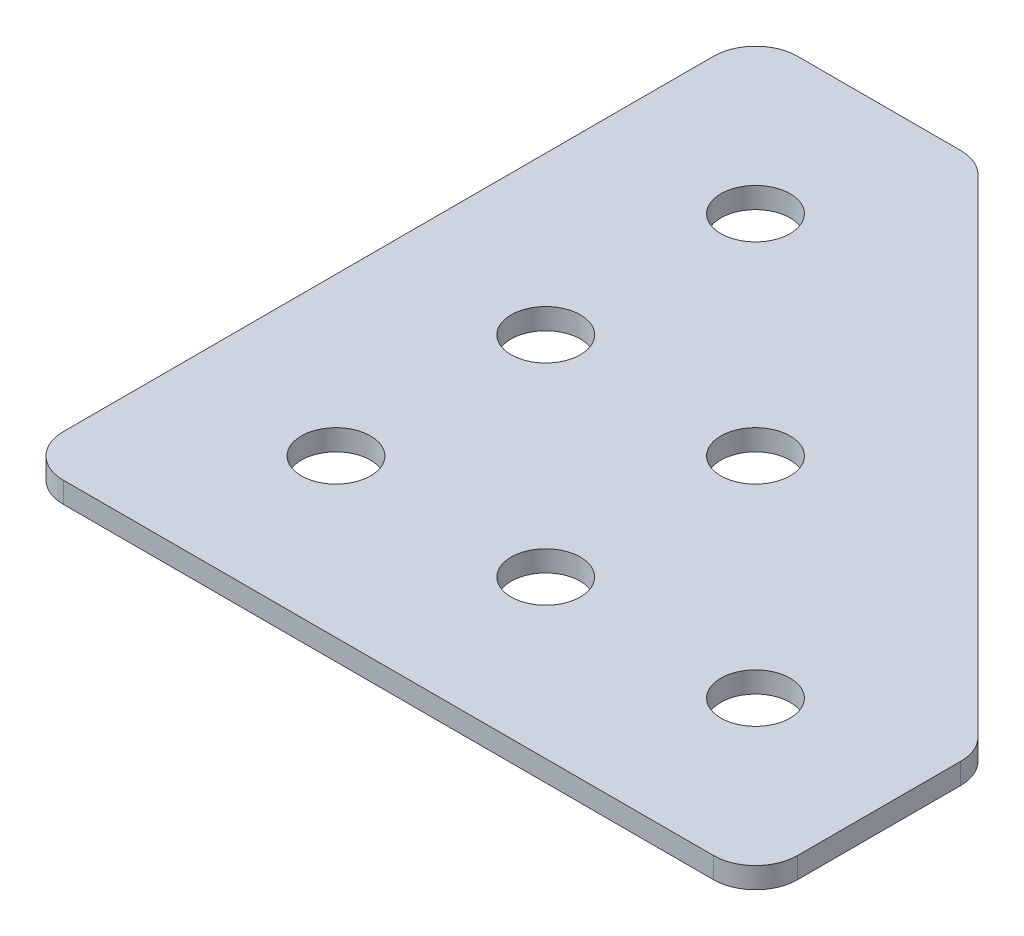
from build123d import *

# Parameters (mm, degrees)
SKETCH1_R           = 1.65
BOSS_EXTRUDE1_DEPTH = 1


with BuildPart() as part:
    # Sketch1 → Boss-Extrude1 (new body)
    with BuildSketch(Plane(origin=(0, 0, 0), x_dir=(1, 0, 0), z_dir=(0, 1, 0))):
        with BuildLine():
            Line((0, 2), (0, 33))
            ThreePointArc((0, 33), (0.585786438, 34.414213562), (2, 35))
            Line((2, 35), (9.778174593, 35))
            ThreePointArc((9.778174593, 35), (10.543541458, 34.847759065), (11.192388155, 34.414213562))
            Line((11.192388155, 34.414213562), (34.414213562, 11.192388155))
            ThreePointArc((34.414213562, 11.192388155), (34.847759065, 10.543541458), (35, 9.778174593))
            Line((35, 9.778174593), (35, 2))
            ThreePointArc((35, 2), (34.414213562, 0.585786438), (33, 0))
            Line((33, 0), (2, 0))
            ThreePointArc((2, 0), (0.585786438, 0.585786438), (0, 2))
        make_face()
        with Locations(Location((7.5, 7.5, 0), (0, 0, 270))):
            Circle(SKETCH1_R, mode=Mode.SUBTRACT)
        with Locations(Location((7.5, 27.5, 0), (0, 0, 270))):
            Circle(SKETCH1_R, mode=Mode.SUBTRACT)
        with Locations(Location((17.5, 7.5, 0), (0, 0, 270))):
            Circle(SKETCH1_R, mode=Mode.SUBTRACT)
        with Locations(Location((27.5, 7.5, 0), (0, 0, 270))):
            Circle(SKETCH1_R, mode=Mode.SUBTRACT)
        with Locations(Location((7.5, 17.5, 0), (0, 0, 270))):
            Circle(SKETCH1_R, mode=Mode.SUBTRACT)
        with Locations(Location((17.5, 17.5, 0), (0, 0, 270))):
            Circle(SKETCH1_R, mode=Mode.SUBTRACT)
    extrude(amount=BOSS_EXTRUDE1_DEPTH)


solid = part.part
